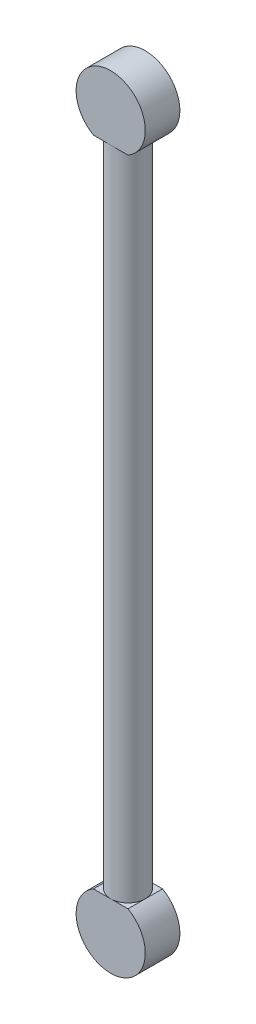
from build123d import *

# Parameters (mm, degrees)
SKETCH1_R         = 3.175
CENTER_ROD_DEPTH  = 119.888
CIRCLE_ENDS_DEPTH = 3.175


with BuildPart() as part:
    # Sketch1 → center rod (new body)
    with BuildSketch(Plane(origin=(0, 0, 0), x_dir=(1, 0, 0), z_dir=(0, 1, 0))):
        with Locations(Location((0, 0, 0), (0, 0, 270))):
            Circle(SKETCH1_R)
    extrude(amount=CENTER_ROD_DEPTH)

    # Sketch2 → circle ends (add, symmetric)
    with BuildSketch(Plane.XY):
        with BuildLine():
            Line((-3.175, 119.888), (3.175, 119.888))
            ThreePointArc((3.175, 119.888), (0, 131.737261314), (-3.175, 119.888))
        make_face()
        with BuildLine():
            Line((-3.175, 0), (3.175, 0))
            ThreePointArc((3.175, 0), (0, -11.849261314), (-3.175, 0))
        make_face()
    extrude(amount=CIRCLE_ENDS_DEPTH, both=True)


solid = part.part
